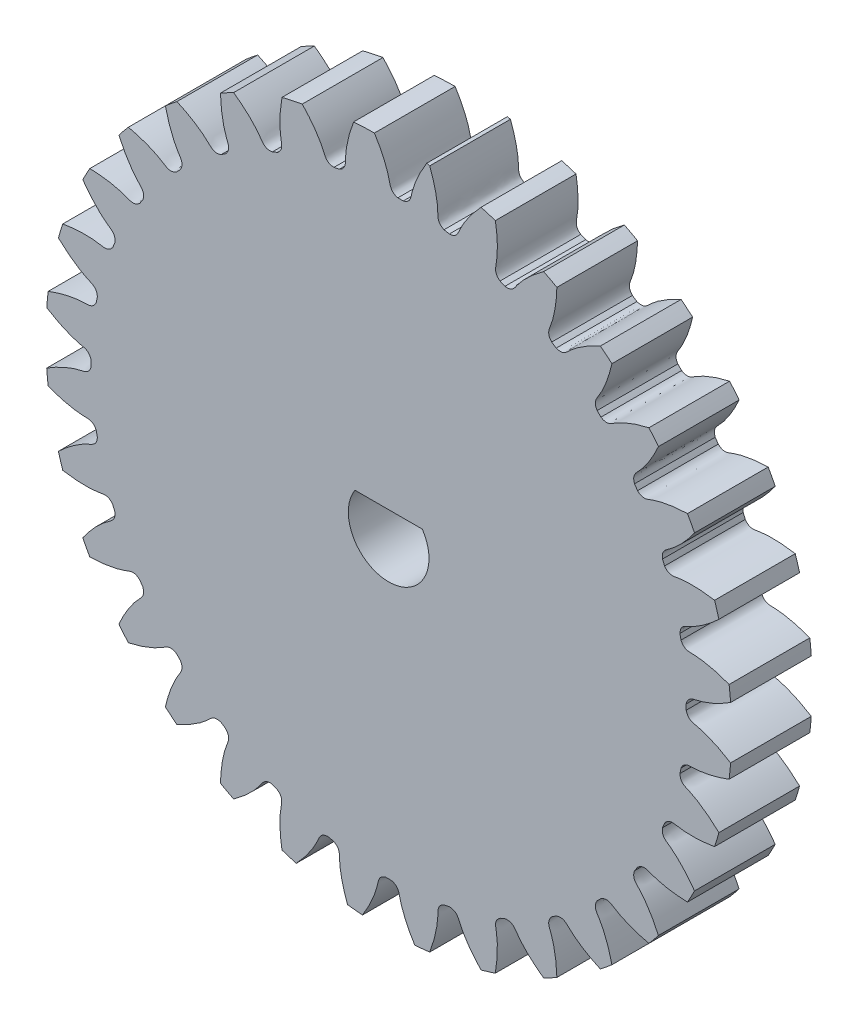
from build123d import *

# Parameters (mm, degrees)
EXTRUDE_1_DEPTH = 4


with BuildPart() as part:
    # 草图1 → 凸台-拉伸1 (new body)
    with BuildSketch(Plane.XY):
        with BuildLine():
            ThreePointArc((2.035278655, 16.877726174), (1.961192732, 16.897850599), (1.887016511, 16.917639603))
            add(Edge.make_bspline(
                [(1.887016511, 16.917639603), (1.838522747, 16.840615375), (1.742307559, 16.681804301), (1.610049844, 16.443752667), (1.492993766, 16.211703966), (1.395259616, 15.997067672), (1.315251975, 15.800982686), (1.251314979, 15.62448833), (1.208490215, 15.489735092), (1.180872939, 15.392512676), (1.163935477, 15.327913088), (1.098877666, 15.059564288), (1.079326327, 14.802321446), (0.724538936, 14.716542054)],
                knots=[0, 0, 0, 0, 0.048514786, 0.098957352, 0.145125777, 0.18702006, 0.224640202, 0.257986203, 0.287058062, 0.299991189, 0.31185578, 0.322651837, 0.447184516, 0.447184516, 0.447184516, 0.447184516], degree=3))
            ThreePointArc((0.724538936, 14.716542054), (0.590506823, 14.717151037), (0.45647471, 14.716542054))
            add(Edge.make_bspline(
                [(0.45647471, 14.716542054), (0.101687318, 14.802321446), (0.08213598, 15.059564288), (0.017078169, 15.327913088), (0.000140707, 15.392512676), (-0.027476569, 15.489735092), (-0.070301333, 15.62448833), (-0.134237826, 15.800982771), (-0.214245733, 15.997067661), (-0.311979866, 16.211703979), (-0.429036077, 16.44375267), (-0.561293368, 16.68180432), (-0.657509102, 16.840615375), (-0.706002865, 16.917639603)],
                knots=[0, 0, 0, 0, 0.124532679, 0.135328735, 0.147193327, 0.160126453, 0.189198313, 0.222544314, 0.260164456, 0.302058739, 0.348227164, 0.39866973, 0.447184516, 0.447184516, 0.447184516, 0.447184516], degree=3))
            ThreePointArc((-0.706002865, 16.917639603), (-1.22268931, 16.905533247), (-1.738768967, 16.877726174))
            add(Edge.make_bspline(
                [(-1.738768967, 16.877726174), (-1.771304255, 16.792721281), (-1.834688191, 16.618191065), (-1.917963042, 16.358911326), (-1.987499465, 16.108484868), (-2.041482217, 15.878905763), (-2.08169825, 15.670979779), (-2.109974374, 15.485403223), (-2.12568722, 15.344884534), (-2.133806685, 15.244142357), (-2.137815944, 15.177479697), (-2.149271434, 14.901594994), (-2.11826151, 14.645480724), (-2.449497032, 14.492133973)],
                knots=[0, 0, 0, 0, 0.048514786, 0.098957352, 0.145125777, 0.18702006, 0.224640202, 0.257986203, 0.287058062, 0.299991189, 0.31185578, 0.322651837, 0.447184516, 0.447184516, 0.447184516, 0.447184516], degree=3))
            ThreePointArc((-2.449497032, 14.492133973), (-2.581072562, 14.466582886), (-2.712410479, 14.439837237))
            add(Edge.make_bspline(
                [(-2.712410479, 14.439837237), (-3.077115459, 14.454752815), (-3.146476713, 14.703238531), (-3.26263671, 14.953738935), (-3.291851478, 15.013792925), (-3.337905248, 15.103759377), (-3.406196199, 15.227568671), (-3.503336528, 15.38819843), (-3.620061369, 15.564906836), (-3.757791037, 15.756351993), (-3.917868499, 15.9611054), (-4.094026077, 16.168780837), (-4.219375552, 16.305769624), (-4.281964203, 16.371853189)],
                knots=[0, 0, 0, 0, 0.124532679, 0.135328735, 0.147193327, 0.160126453, 0.189198313, 0.222544314, 0.260164456, 0.302058739, 0.348227164, 0.39866973, 0.447184516, 0.447184516, 0.447184516, 0.447184516], degree=3))
            ThreePointArc((-4.281964203, 16.371853189), (-4.787040201, 16.271732855), (-5.28885238, 16.15636223))
            add(Edge.make_bspline(
                [(-5.28885238, 16.15636223), (-5.30417888, 16.066643362), (-5.332295756, 15.883101103), (-5.363387535, 15.612557234), (-5.382732057, 15.353376767), (-5.390888884, 15.117677448), (-5.389767831, 14.905900944), (-5.381296447, 14.718373792), (-5.369293538, 14.577489706), (-5.357603167, 14.477099232), (-5.348530149, 14.410935309), (-5.305943089, 14.138116798), (-5.225563597, 13.892973428), (-5.520518054, 13.677952347)],
                knots=[0, 0, 0, 0, 0.048514786, 0.098957352, 0.145125777, 0.18702006, 0.224640202, 0.257986203, 0.287058062, 0.299991189, 0.31185578, 0.322651837, 0.447184516, 0.447184516, 0.447184516, 0.447184516], degree=3))
            ThreePointArc((-5.520518054, 13.677952347), (-5.644580627, 13.627223105), (-5.768177106, 13.575368609))
            add(Edge.make_bspline(
                [(-5.768177106, 13.575368609), (-6.128784267, 13.518847177), (-6.245289922, 13.7490266), (-6.408088142, 13.972052018), (-6.448457509, 14.025252569), (-6.511177953, 14.104505695), (-6.602310707, 14.212613125), (-6.728921823, 14.35120529), (-6.877877929, 14.501746407), (-7.050310258, 14.662643274), (-7.247257284, 14.832232838), (-7.460545511, 15.00155121), (-7.610211618, 15.111453327), (-7.684489909, 15.164056675)],
                knots=[0, 0, 0, 0, 0.124532679, 0.135328735, 0.147193327, 0.160126453, 0.189198313, 0.222544314, 0.260164456, 0.302058739, 0.348227164, 0.39866973, 0.447184516, 0.447184516, 0.447184516, 0.447184516], degree=3))
            ThreePointArc((-7.684489909, 15.164056675), (-8.013744526, 14.992661494), (-8.339178475, 14.814118346))
            add(Edge.make_bspline(
                [(-8.339178475, 14.814118346), (-8.336707198, 14.72313335), (-8.328476497, 14.537632473), (-8.306190366, 14.266221323), (-8.274599588, 14.008247007), (-8.236617027, 13.775485267), (-8.194201968, 13.567996695), (-8.149308627, 13.38572551), (-8.11005123, 13.249890124), (-8.079000275, 13.153709303), (-8.057193652, 13.090586759), (-7.962200639, 12.831318702), (-7.835540517, 12.606566955), (-8.082878975, 12.338134684)],
                knots=[0, 0, 0, 0, 0.048514786, 0.098957352, 0.145125777, 0.18702006, 0.224640202, 0.257986203, 0.287058062, 0.299991189, 0.31185578, 0.322651837, 0.447184516, 0.447184516, 0.447184516, 0.447184516], degree=3))
            ThreePointArc((-8.082878975, 12.338134684), (-8.194660937, 12.264176781), (-8.305766234, 12.189206179))
            add(Edge.make_bspline(
                [(-8.305766234, 12.189206179), (-8.648417645, 12.063419823), (-8.807590454, 12.266447287), (-9.010770653, 12.453426977), (-9.060743246, 12.497729622), (-9.137720052, 12.56322377), (-9.24819243, 12.651474828), (-9.399408738, 12.76270338), (-9.574871809, 12.881291996), (-9.775380321, 13.005457396), (-10.001628348, 13.133365886), (-10.243850678, 13.257820384), (-10.412081831, 13.336412354), (-10.49519529, 13.373513967)],
                knots=[0, 0, 0, 0, 0.124532679, 0.135328735, 0.147193327, 0.160126453, 0.189198313, 0.222544314, 0.260164456, 0.302058739, 0.348227164, 0.39866973, 0.447184516, 0.447184516, 0.447184516, 0.447184516], degree=3))
            ThreePointArc((-10.49519529, 13.373513967), (-10.784685831, 13.141177707), (-11.069034617, 12.902576202))
            add(Edge.make_bspline(
                [(-11.069034617, 12.902576202), (-11.048860533, 12.813821579), (-11.004598556, 12.633490779), (-10.929790959, 12.371642528), (-10.848478896, 12.124788171), (-10.765816597, 11.903908912), (-10.68373752, 11.708681943), (-10.604147447, 11.538671303), (-10.5391442, 11.413104694), (-10.489925934, 11.324829702), (-10.456223721, 11.267174301), (-10.312475284, 11.031420224), (-10.14440201, 10.835697183), (-10.334619391, 10.524169423)],
                knots=[0, 0, 0, 0, 0.048514786, 0.098957352, 0.145125777, 0.18702006, 0.224640202, 0.257986203, 0.287058062, 0.299991189, 0.31185578, 0.322651837, 0.447184516, 0.447184516, 0.447184516, 0.447184516], degree=3))
            ThreePointArc((-10.334619391, 10.524169423), (-10.429825023, 10.429825023), (-10.524169423, 10.334619391))
            add(Edge.make_bspline(
                [(-10.524169423, 10.334619391), (-10.835697183, 10.14440201), (-11.031420224, 10.312475284), (-11.267174301, 10.456223721), (-11.324829702, 10.489925934), (-11.413104694, 10.5391442), (-11.538671303, 10.604147447), (-11.708681647, 10.683737935), (-11.903908736, 10.765816758), (-12.124788, 10.848479085), (-12.371642444, 10.929791048), (-12.633490407, 11.004598956), (-12.813821579, 11.048860533), (-12.902576202, 11.069034617)],
                knots=[0, 0, 0, 0, 0.124532679, 0.135328735, 0.147193327, 0.160126453, 0.189198313, 0.222544314, 0.260164456, 0.302058739, 0.348227164, 0.39866973, 0.447184516, 0.447184516, 0.447184516, 0.447184516], degree=3))
            ThreePointArc((-12.902576202, 11.069034617), (-13.141177707, 10.784685831), (-13.373513967, 10.49519529))
            add(Edge.make_bspline(
                [(-13.373513967, 10.49519529), (-13.336412354, 10.412081831), (-13.257820065, 10.243851121), (-13.133365815, 10.001628448), (-13.005457245, 9.775380525), (-12.881291873, 9.574872013), (-12.762703029, 9.399409109), (-12.651474828, 9.24819243), (-12.56322377, 9.137720052), (-12.497729622, 9.060743246), (-12.453426977, 9.010770653), (-12.266447287, 8.807590454), (-12.063419823, 8.648417645), (-12.189206179, 8.305766234)],
                knots=[0, 0, 0, 0, 0.048514786, 0.098957352, 0.145125777, 0.18702006, 0.224640202, 0.257986203, 0.287058062, 0.299991189, 0.31185578, 0.322651837, 0.447184516, 0.447184516, 0.447184516, 0.447184516], degree=3))
            ThreePointArc((-12.189206179, 8.305766234), (-12.264176781, 8.194660937), (-12.338134684, 8.082878975))
            add(Edge.make_bspline(
                [(-12.338134684, 8.082878975), (-12.606566955, 7.835540517), (-12.831318702, 7.962200639), (-13.090586759, 8.057193652), (-13.153709303, 8.079000275), (-13.249890124, 8.11005123), (-13.38572551, 8.149308627), (-13.567996487, 8.194202434), (-13.775485126, 8.236617219), (-14.008246877, 8.274599806), (-14.266221258, 8.306190469), (-14.537632185, 8.328476961), (-14.72313335, 8.336707198), (-14.814118346, 8.339178475)],
                knots=[0, 0, 0, 0, 0.124532679, 0.135328735, 0.147193327, 0.160126453, 0.189198313, 0.222544314, 0.260164456, 0.302058739, 0.348227164, 0.39866973, 0.447184516, 0.447184516, 0.447184516, 0.447184516], degree=3))
            ThreePointArc((-14.814118346, 8.339178475), (-14.992661494, 8.013744526), (-15.164056675, 7.684489909))
            add(Edge.make_bspline(
                [(-15.164056675, 7.684489909), (-15.111453327, 7.610211618), (-15.001550984, 7.460546008), (-14.832232788, 7.247257396), (-14.662643165, 7.050310487), (-14.501746326, 6.877878153), (-14.351205019, 6.728922255), (-14.212613125, 6.602310707), (-14.104505695, 6.511177953), (-14.025252569, 6.448457509), (-13.972052018, 6.408088142), (-13.7490266, 6.245289922), (-13.518847177, 6.128784267), (-13.575368609, 5.768177106)],
                knots=[0, 0, 0, 0, 0.048514786, 0.098957352, 0.145125777, 0.18702006, 0.224640202, 0.257986203, 0.287058062, 0.299991189, 0.31185578, 0.322651837, 0.447184516, 0.447184516, 0.447184516, 0.447184516], degree=3))
            ThreePointArc((-13.575368609, 5.768177106), (-13.627223105, 5.644580627), (-13.677952347, 5.520518054))
            add(Edge.make_bspline(
                [(-13.677952347, 5.520518054), (-13.892973428, 5.225563597), (-14.138116798, 5.305943089), (-14.410935309, 5.348530149), (-14.477099232, 5.357603167), (-14.577489706, 5.369293538), (-14.718373792, 5.381296447), (-14.90590083, 5.389768328), (-15.117677347, 5.3908891), (-15.353376682, 5.382732297), (-15.612557191, 5.363387649), (-15.883100912, 5.332296267), (-16.066643362, 5.30417888), (-16.15636223, 5.28885238)],
                knots=[0, 0, 0, 0, 0.124532679, 0.135328735, 0.147193327, 0.160126453, 0.189198313, 0.222544314, 0.260164456, 0.302058739, 0.348227164, 0.39866973, 0.447184516, 0.447184516, 0.447184516, 0.447184516], degree=3))
            ThreePointArc((-16.15636223, 5.28885238), (-16.267985707, 4.934839513), (-16.371853189, 4.57847389))
            add(Edge.make_bspline(
                [(-16.371853189, 4.57847389), (-16.305769624, 4.51588524), (-16.168780712, 4.390536296), (-15.961105373, 4.214378306), (-15.756351931, 4.054300971), (-15.5649068, 3.916571292), (-15.388198249, 3.799846692), (-15.227568671, 3.702705887), (-15.103759377, 3.634414936), (-15.013792925, 3.588361166), (-14.953738935, 3.559146398), (-14.703238531, 3.442986401), (-14.454752815, 3.373625147), (-14.439837237, 3.008920167)],
                knots=[0, 0, 0, 0, 0.048514786, 0.098957352, 0.145125777, 0.18702006, 0.224640202, 0.257986203, 0.287058062, 0.299991189, 0.31185578, 0.322651837, 0.447184516, 0.447184516, 0.447184516, 0.447184516], degree=3))
            ThreePointArc((-14.439837237, 3.008920167), (-14.466582886, 2.87758225), (-14.492133973, 2.746006719))
            add(Edge.make_bspline(
                [(-14.492133973, 2.746006719), (-14.645480724, 2.414771197), (-14.901594994, 2.445781121), (-15.177479697, 2.434325632), (-15.244142357, 2.430316373), (-15.344884534, 2.422196908), (-15.485403223, 2.406484062), (-15.670979764, 2.378208448), (-15.878905706, 2.337992135), (-16.108484831, 2.284009404), (-16.358911305, 2.21447285), (-16.618190977, 2.131198418), (-16.792721281, 2.067813943), (-16.877726174, 2.035278655)],
                knots=[0, 0, 0, 0, 0.124532679, 0.135328735, 0.147193327, 0.160126453, 0.189198313, 0.222544314, 0.260164456, 0.302058739, 0.348227164, 0.39866973, 0.447184516, 0.447184516, 0.447184516, 0.447184516], degree=3))
            ThreePointArc((-16.877726174, 2.035278655), (-16.918140353, 1.666291386), (-16.950488566, 1.296509688))
            add(Edge.make_bspline(
                [(-16.950488566, 1.296509688), (-16.873464339, 1.248015924), (-16.714653264, 1.151800737), (-16.47660163, 1.019543022), (-16.244552929, 0.902486943), (-16.029916635, 0.804752793), (-15.833831649, 0.724745152), (-15.657337293, 0.660808156), (-15.522584055, 0.617983392), (-15.42536164, 0.590366116), (-15.360762052, 0.573428654), (-15.092413251, 0.508370843), (-14.835170409, 0.488819505), (-14.749391018, 0.134032113)],
                knots=[0, 0, 0, 0, 0.048514786, 0.098957352, 0.145125777, 0.18702006, 0.224640202, 0.257986203, 0.287058062, 0.299991189, 0.31185578, 0.322651837, 0.447184516, 0.447184516, 0.447184516, 0.447184516], degree=3))
            ThreePointArc((-14.749391018, 0.134032113), (-14.75, 0), (-14.749391018, -0.134032113))
            add(Edge.make_bspline(
                [(-14.749391018, -0.134032113), (-14.835170409, -0.488819505), (-15.092413251, -0.508370843), (-15.360762052, -0.573428654), (-15.42536164, -0.590366116), (-15.522584055, -0.617983392), (-15.657337293, -0.660808156), (-15.833831734, -0.724744649), (-16.029916624, -0.804752555), (-16.244552942, -0.902486689), (-16.476601633, -1.0195429), (-16.714653283, -1.151800191), (-16.873464339, -1.248015924), (-16.950488566, -1.296509688)],
                knots=[0, 0, 0, 0, 0.124532679, 0.135328735, 0.147193327, 0.160126453, 0.189198313, 0.222544314, 0.260164456, 0.302058739, 0.348227164, 0.39866973, 0.447184516, 0.447184516, 0.447184516, 0.447184516], degree=3))
            ThreePointArc((-16.950488566, -1.296509688), (-16.918140353, -1.666291386), (-16.877726174, -2.035278655))
            add(Edge.make_bspline(
                [(-16.877726174, -2.035278655), (-16.792721281, -2.067813943), (-16.618191065, -2.131197879), (-16.358911326, -2.214472729), (-16.108484868, -2.284009152), (-15.878905763, -2.337991904), (-15.670979779, -2.378207938), (-15.485403223, -2.406484062), (-15.344884534, -2.422196908), (-15.244142357, -2.430316373), (-15.177479697, -2.434325632), (-14.901594994, -2.445781121), (-14.645480724, -2.414771197), (-14.492133973, -2.746006719)],
                knots=[0, 0, 0, 0, 0.048514786, 0.098957352, 0.145125777, 0.18702006, 0.224640202, 0.257986203, 0.287058062, 0.299991189, 0.31185578, 0.322651837, 0.447184516, 0.447184516, 0.447184516, 0.447184516], degree=3))
            ThreePointArc((-14.492133973, -2.746006719), (-14.466582886, -2.87758225), (-14.439837237, -3.008920167))
            add(Edge.make_bspline(
                [(-14.439837237, -3.008920167), (-14.454752815, -3.373625147), (-14.703238531, -3.442986401), (-14.953738935, -3.559146398), (-15.013792925, -3.588361166), (-15.103759377, -3.634414936), (-15.227568671, -3.702705887), (-15.38819843, -3.799846215), (-15.564906836, -3.916571057), (-15.756351993, -4.054300725), (-15.9611054, -4.214378187), (-16.168780837, -4.390535765), (-16.305769624, -4.51588524), (-16.371853189, -4.57847389)],
                knots=[0, 0, 0, 0, 0.124532679, 0.135328735, 0.147193327, 0.160126453, 0.189198313, 0.222544314, 0.260164456, 0.302058739, 0.348227164, 0.39866973, 0.447184516, 0.447184516, 0.447184516, 0.447184516], degree=3))
            ThreePointArc((-16.371853189, -4.57847389), (-16.267985707, -4.934839513), (-16.15636223, -5.28885238))
            add(Edge.make_bspline(
                [(-16.15636223, -5.28885238), (-16.066643362, -5.30417888), (-15.883101103, -5.332295756), (-15.612557234, -5.363387535), (-15.353376767, -5.382732057), (-15.117677448, -5.390888884), (-14.905900944, -5.389767831), (-14.718373792, -5.381296447), (-14.577489706, -5.369293538), (-14.477099232, -5.357603167), (-14.410935309, -5.348530149), (-14.138116798, -5.305943089), (-13.892973428, -5.225563597), (-13.677952347, -5.520518054)],
                knots=[0, 0, 0, 0, 0.048514786, 0.098957352, 0.145125777, 0.18702006, 0.224640202, 0.257986203, 0.287058062, 0.299991189, 0.31185578, 0.322651837, 0.447184516, 0.447184516, 0.447184516, 0.447184516], degree=3))
            ThreePointArc((-13.677952347, -5.520518054), (-13.627223105, -5.644580627), (-13.575368609, -5.768177106))
            add(Edge.make_bspline(
                [(-13.575368609, -5.768177106), (-13.518847177, -6.128784267), (-13.7490266, -6.245289922), (-13.972052018, -6.408088142), (-14.025252569, -6.448457509), (-14.104505695, -6.511177953), (-14.212613125, -6.602310707), (-14.35120529, -6.728921823), (-14.501746407, -6.877877929), (-14.662643274, -7.050310258), (-14.832232838, -7.247257284), (-15.00155121, -7.460545511), (-15.111453327, -7.610211618), (-15.164056675, -7.684489909)],
                knots=[0, 0, 0, 0, 0.124532679, 0.135328735, 0.147193327, 0.160126453, 0.189198313, 0.222544314, 0.260164456, 0.302058739, 0.348227164, 0.39866973, 0.447184516, 0.447184516, 0.447184516, 0.447184516], degree=3))
            ThreePointArc((-15.164056675, -7.684489909), (-14.992661494, -8.013744526), (-14.814118346, -8.339178475))
            add(Edge.make_bspline(
                [(-14.814118346, -8.339178475), (-14.72313335, -8.336707198), (-14.537632473, -8.328476497), (-14.266221323, -8.306190366), (-14.008247007, -8.274599588), (-13.775485267, -8.236617027), (-13.567996695, -8.194201968), (-13.38572551, -8.149308627), (-13.249890124, -8.11005123), (-13.153709303, -8.079000275), (-13.090586759, -8.057193652), (-12.831318702, -7.962200639), (-12.606566955, -7.835540517), (-12.338134684, -8.082878975)],
                knots=[0, 0, 0, 0, 0.048514786, 0.098957352, 0.145125777, 0.18702006, 0.224640202, 0.257986203, 0.287058062, 0.299991189, 0.31185578, 0.322651837, 0.447184516, 0.447184516, 0.447184516, 0.447184516], degree=3))
            ThreePointArc((-12.338134684, -8.082878975), (-12.264176781, -8.194660937), (-12.189206179, -8.305766234))
            add(Edge.make_bspline(
                [(-12.189206179, -8.305766234), (-12.063419823, -8.648417645), (-12.266447287, -8.807590454), (-12.453426977, -9.010770653), (-12.497729622, -9.060743246), (-12.56322377, -9.137720052), (-12.651474828, -9.24819243), (-12.76270338, -9.399408738), (-12.881291996, -9.574871809), (-13.005457396, -9.775380321), (-13.133365886, -10.001628348), (-13.257820384, -10.243850678), (-13.336412354, -10.412081831), (-13.373513967, -10.49519529)],
                knots=[0, 0, 0, 0, 0.124532679, 0.135328735, 0.147193327, 0.160126453, 0.189198313, 0.222544314, 0.260164456, 0.302058739, 0.348227164, 0.39866973, 0.447184516, 0.447184516, 0.447184516, 0.447184516], degree=3))
            ThreePointArc((-13.373513967, -10.49519529), (-13.141177707, -10.784685831), (-12.902576202, -11.069034617))
            add(Edge.make_bspline(
                [(-12.902576202, -11.069034617), (-12.813821579, -11.048860533), (-12.633490779, -11.004598556), (-12.371642528, -10.929790959), (-12.124788171, -10.848478896), (-11.903908912, -10.765816597), (-11.708681943, -10.68373752), (-11.538671303, -10.604147447), (-11.413104694, -10.5391442), (-11.324829702, -10.489925934), (-11.267174301, -10.456223721), (-11.031420224, -10.312475284), (-10.835697183, -10.14440201), (-10.524169423, -10.334619391)],
                knots=[0, 0, 0, 0, 0.048514786, 0.098957352, 0.145125777, 0.18702006, 0.224640202, 0.257986203, 0.287058062, 0.299991189, 0.31185578, 0.322651837, 0.447184516, 0.447184516, 0.447184516, 0.447184516], degree=3))
            ThreePointArc((-10.524169423, -10.334619391), (-10.429825023, -10.429825023), (-10.334619391, -10.524169423))
            add(Edge.make_bspline(
                [(-10.334619391, -10.524169423), (-10.14440201, -10.835697183), (-10.312475284, -11.031420224), (-10.456223721, -11.267174301), (-10.489925934, -11.324829702), (-10.5391442, -11.413104694), (-10.604147447, -11.538671303), (-10.683737935, -11.708681647), (-10.765816758, -11.903908736), (-10.848479085, -12.124788), (-10.929791048, -12.371642444), (-11.004598956, -12.633490407), (-11.048860533, -12.813821579), (-11.069034617, -12.902576202)],
                knots=[0, 0, 0, 0, 0.124532679, 0.135328735, 0.147193327, 0.160126453, 0.189198313, 0.222544314, 0.260164456, 0.302058739, 0.348227164, 0.39866973, 0.447184516, 0.447184516, 0.447184516, 0.447184516], degree=3))
            ThreePointArc((-11.069034617, -12.902576202), (-10.784685831, -13.141177707), (-10.49519529, -13.373513967))
            add(Edge.make_bspline(
                [(-10.49519529, -13.373513967), (-10.412081831, -13.336412354), (-10.243851121, -13.257820065), (-10.001628448, -13.133365815), (-9.775380525, -13.005457245), (-9.574872013, -12.881291873), (-9.399409109, -12.762703029), (-9.24819243, -12.651474828), (-9.137720052, -12.56322377), (-9.060743246, -12.497729622), (-9.010770653, -12.453426977), (-8.807590454, -12.266447287), (-8.648417645, -12.063419823), (-8.305766234, -12.189206179)],
                knots=[0, 0, 0, 0, 0.048514786, 0.098957352, 0.145125777, 0.18702006, 0.224640202, 0.257986203, 0.287058062, 0.299991189, 0.31185578, 0.322651837, 0.447184516, 0.447184516, 0.447184516, 0.447184516], degree=3))
            ThreePointArc((-8.305766234, -12.189206179), (-8.194660937, -12.264176781), (-8.082878975, -12.338134684))
            add(Edge.make_bspline(
                [(-8.082878975, -12.338134684), (-7.835540517, -12.606566955), (-7.962200639, -12.831318702), (-8.057193652, -13.090586759), (-8.079000275, -13.153709303), (-8.11005123, -13.249890124), (-8.149308627, -13.38572551), (-8.194202434, -13.567996487), (-8.236617219, -13.775485126), (-8.274599806, -14.008246877), (-8.306190469, -14.266221258), (-8.328476961, -14.537632185), (-8.336707198, -14.72313335), (-8.339178475, -14.814118346)],
                knots=[0, 0, 0, 0, 0.124532679, 0.135328735, 0.147193327, 0.160126453, 0.189198313, 0.222544314, 0.260164456, 0.302058739, 0.348227164, 0.39866973, 0.447184516, 0.447184516, 0.447184516, 0.447184516], degree=3))
            ThreePointArc((-8.339178475, -14.814118346), (-8.013744526, -14.992661494), (-7.684489909, -15.164056675))
            add(Edge.make_bspline(
                [(-7.684489909, -15.164056675), (-7.610211618, -15.111453327), (-7.460546008, -15.001550984), (-7.247257396, -14.832232788), (-7.050310487, -14.662643165), (-6.877878153, -14.501746326), (-6.728922255, -14.351205019), (-6.602310707, -14.212613125), (-6.511177953, -14.104505695), (-6.448457509, -14.025252569), (-6.408088142, -13.972052018), (-6.245289922, -13.7490266), (-6.128784267, -13.518847177), (-5.768177106, -13.575368609)],
                knots=[0, 0, 0, 0, 0.048514786, 0.098957352, 0.145125777, 0.18702006, 0.224640202, 0.257986203, 0.287058062, 0.299991189, 0.31185578, 0.322651837, 0.447184516, 0.447184516, 0.447184516, 0.447184516], degree=3))
            ThreePointArc((-5.768177106, -13.575368609), (-5.644580627, -13.627223105), (-5.520518054, -13.677952347))
            add(Edge.make_bspline(
                [(-5.520518054, -13.677952347), (-5.225563597, -13.892973428), (-5.305943089, -14.138116798), (-5.348530149, -14.410935309), (-5.357603167, -14.477099232), (-5.369293538, -14.577489706), (-5.381296447, -14.718373792), (-5.389768328, -14.90590083), (-5.3908891, -15.117677347), (-5.382732297, -15.353376682), (-5.363387649, -15.612557191), (-5.332296267, -15.883100912), (-5.30417888, -16.066643362), (-5.28885238, -16.15636223)],
                knots=[0, 0, 0, 0, 0.124532679, 0.135328735, 0.147193327, 0.160126453, 0.189198313, 0.222544314, 0.260164456, 0.302058739, 0.348227164, 0.39866973, 0.447184516, 0.447184516, 0.447184516, 0.447184516], degree=3))
            ThreePointArc((-5.28885238, -16.15636223), (-4.934839513, -16.267985707), (-4.57847389, -16.371853189))
            add(Edge.make_bspline(
                [(-4.57847389, -16.371853189), (-4.51588524, -16.305769624), (-4.390536296, -16.168780712), (-4.214378306, -15.961105373), (-4.054300971, -15.756351931), (-3.916571292, -15.5649068), (-3.799846692, -15.388198249), (-3.702705887, -15.227568671), (-3.634414936, -15.103759377), (-3.588361166, -15.013792925), (-3.559146398, -14.953738935), (-3.442986401, -14.703238531), (-3.373625147, -14.454752815), (-3.008920167, -14.439837237)],
                knots=[0, 0, 0, 0, 0.048514786, 0.098957352, 0.145125777, 0.18702006, 0.224640202, 0.257986203, 0.287058062, 0.299991189, 0.31185578, 0.322651837, 0.447184516, 0.447184516, 0.447184516, 0.447184516], degree=3))
            ThreePointArc((-3.008920167, -14.439837237), (-2.87758225, -14.466582886), (-2.746006719, -14.492133973))
            add(Edge.make_bspline(
                [(-2.746006719, -14.492133973), (-2.414771197, -14.645480724), (-2.445781121, -14.901594994), (-2.434325632, -15.177479697), (-2.430316373, -15.244142357), (-2.422196908, -15.344884534), (-2.406484062, -15.485403223), (-2.378208448, -15.670979764), (-2.337992135, -15.878905706), (-2.284009404, -16.108484831), (-2.21447285, -16.358911305), (-2.131198418, -16.618190977), (-2.067813943, -16.792721281), (-2.035278655, -16.877726174)],
                knots=[0, 0, 0, 0, 0.124532679, 0.135328735, 0.147193327, 0.160126453, 0.189198313, 0.222544314, 0.260164456, 0.302058739, 0.348227164, 0.39866973, 0.447184516, 0.447184516, 0.447184516, 0.447184516], degree=3))
            ThreePointArc((-2.035278655, -16.877726174), (-1.666291386, -16.918140353), (-1.296509688, -16.950488566))
            add(Edge.make_bspline(
                [(-1.296509688, -16.950488566), (-1.248015924, -16.873464339), (-1.151800737, -16.714653264), (-1.019543022, -16.47660163), (-0.902486943, -16.244552929), (-0.804752793, -16.029916635), (-0.724745152, -15.833831649), (-0.660808156, -15.657337293), (-0.617983392, -15.522584055), (-0.590366116, -15.42536164), (-0.573428654, -15.360762052), (-0.508370843, -15.092413251), (-0.488819505, -14.835170409), (-0.134032113, -14.749391018)],
                knots=[0, 0, 0, 0, 0.048514786, 0.098957352, 0.145125777, 0.18702006, 0.224640202, 0.257986203, 0.287058062, 0.299991189, 0.31185578, 0.322651837, 0.447184516, 0.447184516, 0.447184516, 0.447184516], degree=3))
            ThreePointArc((-0.134032113, -14.749391018), (0, -14.75), (0.134032113, -14.749391018))
            add(Edge.make_bspline(
                [(0.134032113, -14.749391018), (0.488819505, -14.835170409), (0.508370843, -15.092413251), (0.573428654, -15.360762052), (0.590366116, -15.42536164), (0.617983392, -15.522584055), (0.660808156, -15.657337293), (0.724744649, -15.833831734), (0.804752555, -16.029916624), (0.902486689, -16.244552942), (1.0195429, -16.476601633), (1.151800191, -16.714653283), (1.248015924, -16.873464339), (1.296509688, -16.950488566)],
                knots=[0, 0, 0, 0, 0.124532679, 0.135328735, 0.147193327, 0.160126453, 0.189198313, 0.222544314, 0.260164456, 0.302058739, 0.348227164, 0.39866973, 0.447184516, 0.447184516, 0.447184516, 0.447184516], degree=3))
            ThreePointArc((1.296509688, -16.950488566), (1.666291386, -16.918140353), (2.035278655, -16.877726174))
            add(Edge.make_bspline(
                [(2.035278655, -16.877726174), (2.067813943, -16.792721281), (2.131197879, -16.618191065), (2.214472729, -16.358911326), (2.284009152, -16.108484868), (2.337991904, -15.878905763), (2.378207938, -15.670979779), (2.406484062, -15.485403223), (2.422196908, -15.344884534), (2.430316373, -15.244142357), (2.434325632, -15.177479697), (2.445781121, -14.901594994), (2.414771197, -14.645480724), (2.746006719, -14.492133973)],
                knots=[0, 0, 0, 0, 0.048514786, 0.098957352, 0.145125777, 0.18702006, 0.224640202, 0.257986203, 0.287058062, 0.299991189, 0.31185578, 0.322651837, 0.447184516, 0.447184516, 0.447184516, 0.447184516], degree=3))
            ThreePointArc((2.746006719, -14.492133973), (2.87758225, -14.466582886), (3.008920167, -14.439837237))
            add(Edge.make_bspline(
                [(3.008920167, -14.439837237), (3.373625147, -14.454752815), (3.442986401, -14.703238531), (3.559146398, -14.953738935), (3.588361166, -15.013792925), (3.634414936, -15.103759377), (3.702705887, -15.227568671), (3.799846215, -15.38819843), (3.916571057, -15.564906836), (4.054300725, -15.756351993), (4.214378187, -15.9611054), (4.390535765, -16.168780837), (4.51588524, -16.305769624), (4.57847389, -16.371853189)],
                knots=[0, 0, 0, 0, 0.124532679, 0.135328735, 0.147193327, 0.160126453, 0.189198313, 0.222544314, 0.260164456, 0.302058739, 0.348227164, 0.39866973, 0.447184516, 0.447184516, 0.447184516, 0.447184516], degree=3))
            ThreePointArc((4.57847389, -16.371853189), (4.934839513, -16.267985707), (5.28885238, -16.15636223))
            add(Edge.make_bspline(
                [(5.28885238, -16.15636223), (5.30417888, -16.066643362), (5.332295756, -15.883101103), (5.363387535, -15.612557234), (5.382732057, -15.353376767), (5.390888884, -15.117677448), (5.389767831, -14.905900944), (5.381296447, -14.718373792), (5.369293538, -14.577489706), (5.357603167, -14.477099232), (5.348530149, -14.410935309), (5.305943089, -14.138116798), (5.225563597, -13.892973428), (5.520518054, -13.677952347)],
                knots=[0, 0, 0, 0, 0.048514786, 0.098957352, 0.145125777, 0.18702006, 0.224640202, 0.257986203, 0.287058062, 0.299991189, 0.31185578, 0.322651837, 0.447184516, 0.447184516, 0.447184516, 0.447184516], degree=3))
            ThreePointArc((5.520518054, -13.677952347), (5.644580627, -13.627223105), (5.768177106, -13.575368609))
            add(Edge.make_bspline(
                [(5.768177106, -13.575368609), (6.128784267, -13.518847177), (6.245289922, -13.7490266), (6.408088142, -13.972052018), (6.448457509, -14.025252569), (6.511177953, -14.104505695), (6.602310707, -14.212613125), (6.728921823, -14.35120529), (6.877877929, -14.501746407), (7.050310258, -14.662643274), (7.247257284, -14.832232838), (7.460545511, -15.00155121), (7.610211618, -15.111453327), (7.684489909, -15.164056675)],
                knots=[0, 0, 0, 0, 0.124532679, 0.135328735, 0.147193327, 0.160126453, 0.189198313, 0.222544314, 0.260164456, 0.302058739, 0.348227164, 0.39866973, 0.447184516, 0.447184516, 0.447184516, 0.447184516], degree=3))
            ThreePointArc((7.684489909, -15.164056675), (8.013744526, -14.992661494), (8.339178475, -14.814118346))
            add(Edge.make_bspline(
                [(8.339178475, -14.814118346), (8.336707198, -14.72313335), (8.328476497, -14.537632473), (8.306190366, -14.266221323), (8.274599588, -14.008247007), (8.236617027, -13.775485267), (8.194201968, -13.567996695), (8.149308627, -13.38572551), (8.11005123, -13.249890124), (8.079000275, -13.153709303), (8.057193652, -13.090586759), (7.962200639, -12.831318702), (7.835540517, -12.606566955), (8.082878975, -12.338134684)],
                knots=[0, 0, 0, 0, 0.048514786, 0.098957352, 0.145125777, 0.18702006, 0.224640202, 0.257986203, 0.287058062, 0.299991189, 0.31185578, 0.322651837, 0.447184516, 0.447184516, 0.447184516, 0.447184516], degree=3))
            ThreePointArc((8.082878975, -12.338134684), (8.194660937, -12.264176781), (8.305766234, -12.189206179))
            add(Edge.make_bspline(
                [(8.305766234, -12.189206179), (8.648417645, -12.063419823), (8.807590454, -12.266447287), (9.010770653, -12.453426977), (9.060743246, -12.497729622), (9.137720052, -12.56322377), (9.24819243, -12.651474828), (9.399408738, -12.76270338), (9.574871809, -12.881291996), (9.775380321, -13.005457396), (10.001628348, -13.133365886), (10.243850678, -13.257820384), (10.412081831, -13.336412354), (10.49519529, -13.373513967)],
                knots=[0, 0, 0, 0, 0.124532679, 0.135328735, 0.147193327, 0.160126453, 0.189198313, 0.222544314, 0.260164456, 0.302058739, 0.348227164, 0.39866973, 0.447184516, 0.447184516, 0.447184516, 0.447184516], degree=3))
            ThreePointArc((10.49519529, -13.373513967), (10.784685831, -13.141177707), (11.069034617, -12.902576202))
            add(Edge.make_bspline(
                [(11.069034617, -12.902576202), (11.048860533, -12.813821579), (11.004598556, -12.633490779), (10.929790959, -12.371642528), (10.848478896, -12.124788171), (10.765816597, -11.903908912), (10.68373752, -11.708681943), (10.604147447, -11.538671303), (10.5391442, -11.413104694), (10.489925934, -11.324829702), (10.456223721, -11.267174301), (10.312475284, -11.031420224), (10.14440201, -10.835697183), (10.334619391, -10.524169423)],
                knots=[0, 0, 0, 0, 0.048514786, 0.098957352, 0.145125777, 0.18702006, 0.224640202, 0.257986203, 0.287058062, 0.299991189, 0.31185578, 0.322651837, 0.447184516, 0.447184516, 0.447184516, 0.447184516], degree=3))
            ThreePointArc((10.334619391, -10.524169423), (10.429825023, -10.429825023), (10.524169423, -10.334619391))
            add(Edge.make_bspline(
                [(10.524169423, -10.334619391), (10.835697183, -10.14440201), (11.031420224, -10.312475284), (11.267174301, -10.456223721), (11.324829702, -10.489925934), (11.413104694, -10.5391442), (11.538671303, -10.604147447), (11.708681647, -10.683737935), (11.903908736, -10.765816758), (12.124788, -10.848479085), (12.371642444, -10.929791048), (12.633490407, -11.004598956), (12.813821579, -11.048860533), (12.902576202, -11.069034617)],
                knots=[0, 0, 0, 0, 0.124532679, 0.135328735, 0.147193327, 0.160126453, 0.189198313, 0.222544314, 0.260164456, 0.302058739, 0.348227164, 0.39866973, 0.447184516, 0.447184516, 0.447184516, 0.447184516], degree=3))
            ThreePointArc((12.902576202, -11.069034617), (13.141177707, -10.784685831), (13.373513967, -10.49519529))
            add(Edge.make_bspline(
                [(13.373513967, -10.49519529), (13.336412354, -10.412081831), (13.257820065, -10.243851121), (13.133365815, -10.001628448), (13.005457245, -9.775380525), (12.881291873, -9.574872013), (12.762703029, -9.399409109), (12.651474828, -9.24819243), (12.56322377, -9.137720052), (12.497729622, -9.060743246), (12.453426977, -9.010770653), (12.266447287, -8.807590454), (12.063419823, -8.648417645), (12.189206179, -8.305766234)],
                knots=[0, 0, 0, 0, 0.048514786, 0.098957352, 0.145125777, 0.18702006, 0.224640202, 0.257986203, 0.287058062, 0.299991189, 0.31185578, 0.322651837, 0.447184516, 0.447184516, 0.447184516, 0.447184516], degree=3))
            ThreePointArc((12.189206179, -8.305766234), (12.264176781, -8.194660937), (12.338134684, -8.082878975))
            add(Edge.make_bspline(
                [(12.338134684, -8.082878975), (12.606566955, -7.835540517), (12.831318702, -7.962200639), (13.090586759, -8.057193652), (13.153709303, -8.079000275), (13.249890124, -8.11005123), (13.38572551, -8.149308627), (13.567996487, -8.194202434), (13.775485126, -8.236617219), (14.008246877, -8.274599806), (14.266221258, -8.306190469), (14.537632185, -8.328476961), (14.72313335, -8.336707198), (14.814118346, -8.339178475)],
                knots=[0, 0, 0, 0, 0.124532679, 0.135328735, 0.147193327, 0.160126453, 0.189198313, 0.222544314, 0.260164456, 0.302058739, 0.348227164, 0.39866973, 0.447184516, 0.447184516, 0.447184516, 0.447184516], degree=3))
            ThreePointArc((14.814118346, -8.339178475), (14.992661494, -8.013744526), (15.164056675, -7.684489909))
            add(Edge.make_bspline(
                [(15.164056675, -7.684489909), (15.111453327, -7.610211618), (15.001550984, -7.460546008), (14.832232788, -7.247257396), (14.662643165, -7.050310487), (14.501746326, -6.877878153), (14.351205019, -6.728922255), (14.212613125, -6.602310707), (14.104505695, -6.511177953), (14.025252569, -6.448457509), (13.972052018, -6.408088142), (13.7490266, -6.245289922), (13.518847177, -6.128784267), (13.575368609, -5.768177106)],
                knots=[0, 0, 0, 0, 0.048514786, 0.098957352, 0.145125777, 0.18702006, 0.224640202, 0.257986203, 0.287058062, 0.299991189, 0.31185578, 0.322651837, 0.447184516, 0.447184516, 0.447184516, 0.447184516], degree=3))
            ThreePointArc((13.575368609, -5.768177106), (13.627223105, -5.644580627), (13.677952347, -5.520518054))
            add(Edge.make_bspline(
                [(13.677952347, -5.520518054), (13.892973428, -5.225563597), (14.138116798, -5.305943089), (14.410935309, -5.348530149), (14.477099232, -5.357603167), (14.577489706, -5.369293538), (14.718373792, -5.381296447), (14.90590083, -5.389768328), (15.117677347, -5.3908891), (15.353376682, -5.382732297), (15.612557191, -5.363387649), (15.883100912, -5.332296267), (16.066643362, -5.30417888), (16.15636223, -5.28885238)],
                knots=[0, 0, 0, 0, 0.124532679, 0.135328735, 0.147193327, 0.160126453, 0.189198313, 0.222544314, 0.260164456, 0.302058739, 0.348227164, 0.39866973, 0.447184516, 0.447184516, 0.447184516, 0.447184516], degree=3))
            ThreePointArc((16.15636223, -5.28885238), (16.267985707, -4.934839513), (16.371853189, -4.57847389))
            add(Edge.make_bspline(
                [(16.371853189, -4.57847389), (16.305769624, -4.51588524), (16.168780712, -4.390536296), (15.961105373, -4.214378306), (15.756351931, -4.054300971), (15.5649068, -3.916571292), (15.388198249, -3.799846692), (15.227568671, -3.702705887), (15.103759377, -3.634414936), (15.013792925, -3.588361166), (14.953738935, -3.559146398), (14.703238531, -3.442986401), (14.454752815, -3.373625147), (14.439837237, -3.008920167)],
                knots=[0, 0, 0, 0, 0.048514786, 0.098957352, 0.145125777, 0.18702006, 0.224640202, 0.257986203, 0.287058062, 0.299991189, 0.31185578, 0.322651837, 0.447184516, 0.447184516, 0.447184516, 0.447184516], degree=3))
            ThreePointArc((14.439837237, -3.008920167), (14.466582886, -2.87758225), (14.492133973, -2.746006719))
            add(Edge.make_bspline(
                [(14.492133973, -2.746006719), (14.645480724, -2.414771197), (14.901594994, -2.445781121), (15.177479697, -2.434325632), (15.244142357, -2.430316373), (15.344884534, -2.422196908), (15.485403223, -2.406484062), (15.670979764, -2.378208448), (15.878905706, -2.337992135), (16.108484831, -2.284009404), (16.358911305, -2.21447285), (16.618190977, -2.131198418), (16.792721281, -2.067813943), (16.877726174, -2.035278655)],
                knots=[0, 0, 0, 0, 0.124532679, 0.135328735, 0.147193327, 0.160126453, 0.189198313, 0.222544314, 0.260164456, 0.302058739, 0.348227164, 0.39866973, 0.447184516, 0.447184516, 0.447184516, 0.447184516], degree=3))
            ThreePointArc((16.877726174, -2.035278655), (16.918140353, -1.666291386), (16.950488566, -1.296509688))
            add(Edge.make_bspline(
                [(16.950488566, -1.296509688), (16.873464339, -1.248015924), (16.714653264, -1.151800737), (16.47660163, -1.019543022), (16.244552929, -0.902486943), (16.029916635, -0.804752793), (15.833831649, -0.724745152), (15.657337293, -0.660808156), (15.522584055, -0.617983392), (15.42536164, -0.590366116), (15.360762052, -0.573428654), (15.092413251, -0.508370843), (14.835170409, -0.488819505), (14.749391018, -0.134032113)],
                knots=[0, 0, 0, 0, 0.048514786, 0.098957352, 0.145125777, 0.18702006, 0.224640202, 0.257986203, 0.287058062, 0.299991189, 0.31185578, 0.322651837, 0.447184516, 0.447184516, 0.447184516, 0.447184516], degree=3))
            ThreePointArc((14.749391018, -0.134032113), (14.75, 0), (14.749391018, 0.134032113))
            add(Edge.make_bspline(
                [(14.749391018, 0.134032113), (14.835170409, 0.488819505), (15.092413251, 0.508370843), (15.360762052, 0.573428654), (15.42536164, 0.590366116), (15.522584055, 0.617983392), (15.657337293, 0.660808156), (15.833831734, 0.724744649), (16.029916624, 0.804752555), (16.244552942, 0.902486689), (16.476601633, 1.0195429), (16.714653283, 1.151800191), (16.873464339, 1.248015924), (16.950488566, 1.296509688)],
                knots=[0, 0, 0, 0, 0.124532679, 0.135328735, 0.147193327, 0.160126453, 0.189198313, 0.222544314, 0.260164456, 0.302058739, 0.348227164, 0.39866973, 0.447184516, 0.447184516, 0.447184516, 0.447184516], degree=3))
            ThreePointArc((16.950488566, 1.296509688), (16.918140353, 1.666291386), (16.877726174, 2.035278655))
            add(Edge.make_bspline(
                [(16.877726174, 2.035278655), (16.792721281, 2.067813943), (16.618191065, 2.131197879), (16.358911326, 2.214472729), (16.108484868, 2.284009152), (15.878905763, 2.337991904), (15.670979779, 2.378207938), (15.485403223, 2.406484062), (15.344884534, 2.422196908), (15.244142357, 2.430316373), (15.177479697, 2.434325632), (14.901594994, 2.445781121), (14.645480724, 2.414771197), (14.492133973, 2.746006719)],
                knots=[0, 0, 0, 0, 0.048514786, 0.098957352, 0.145125777, 0.18702006, 0.224640202, 0.257986203, 0.287058062, 0.299991189, 0.31185578, 0.322651837, 0.447184516, 0.447184516, 0.447184516, 0.447184516], degree=3))
            ThreePointArc((14.492133973, 2.746006719), (14.466582886, 2.87758225), (14.439837237, 3.008920167))
            add(Edge.make_bspline(
                [(14.439837237, 3.008920167), (14.454752815, 3.373625147), (14.703238531, 3.442986401), (14.953738935, 3.559146398), (15.013792925, 3.588361166), (15.103759377, 3.634414936), (15.227568671, 3.702705887), (15.38819843, 3.799846215), (15.564906836, 3.916571057), (15.756351993, 4.054300725), (15.9611054, 4.214378187), (16.168780837, 4.390535765), (16.305769624, 4.51588524), (16.371853189, 4.57847389)],
                knots=[0, 0, 0, 0, 0.124532679, 0.135328735, 0.147193327, 0.160126453, 0.189198313, 0.222544314, 0.260164456, 0.302058739, 0.348227164, 0.39866973, 0.447184516, 0.447184516, 0.447184516, 0.447184516], degree=3))
            ThreePointArc((16.371853189, 4.57847389), (16.267985707, 4.934839513), (16.15636223, 5.28885238))
            add(Edge.make_bspline(
                [(16.15636223, 5.28885238), (16.066643362, 5.30417888), (15.883101103, 5.332295756), (15.612557234, 5.363387535), (15.353376767, 5.382732057), (15.117677448, 5.390888884), (14.905900944, 5.389767831), (14.718373792, 5.381296447), (14.577489706, 5.369293538), (14.477099232, 5.357603167), (14.410935309, 5.348530149), (14.138116798, 5.305943089), (13.892973428, 5.225563597), (13.677952347, 5.520518054)],
                knots=[0, 0, 0, 0, 0.048514786, 0.098957352, 0.145125777, 0.18702006, 0.224640202, 0.257986203, 0.287058062, 0.299991189, 0.31185578, 0.322651837, 0.447184516, 0.447184516, 0.447184516, 0.447184516], degree=3))
            ThreePointArc((13.677952347, 5.520518054), (13.627223105, 5.644580627), (13.575368609, 5.768177106))
            add(Edge.make_bspline(
                [(13.575368609, 5.768177106), (13.518847177, 6.128784267), (13.7490266, 6.245289922), (13.972052018, 6.408088142), (14.025252569, 6.448457509), (14.104505695, 6.511177953), (14.212613125, 6.602310707), (14.35120529, 6.728921823), (14.501746407, 6.877877929), (14.662643274, 7.050310258), (14.832232838, 7.247257284), (15.00155121, 7.460545511), (15.111453327, 7.610211618), (15.164056675, 7.684489909)],
                knots=[0, 0, 0, 0, 0.124532679, 0.135328735, 0.147193327, 0.160126453, 0.189198313, 0.222544314, 0.260164456, 0.302058739, 0.348227164, 0.39866973, 0.447184516, 0.447184516, 0.447184516, 0.447184516], degree=3))
            ThreePointArc((15.164056675, 7.684489909), (14.992661494, 8.013744526), (14.814118346, 8.339178475))
            add(Edge.make_bspline(
                [(14.814118346, 8.339178475), (14.72313335, 8.336707198), (14.537632473, 8.328476497), (14.266221323, 8.306190366), (14.008247007, 8.274599588), (13.775485267, 8.236617027), (13.567996695, 8.194201968), (13.38572551, 8.149308627), (13.249890124, 8.11005123), (13.153709303, 8.079000275), (13.090586759, 8.057193652), (12.831318702, 7.962200639), (12.606566955, 7.835540517), (12.338134684, 8.082878975)],
                knots=[0, 0, 0, 0, 0.048514786, 0.098957352, 0.145125777, 0.18702006, 0.224640202, 0.257986203, 0.287058062, 0.299991189, 0.31185578, 0.322651837, 0.447184516, 0.447184516, 0.447184516, 0.447184516], degree=3))
            ThreePointArc((12.338134684, 8.082878975), (12.264176781, 8.194660937), (12.189206179, 8.305766234))
            add(Edge.make_bspline(
                [(12.189206179, 8.305766234), (12.063419823, 8.648417645), (12.266447287, 8.807590454), (12.453426977, 9.010770653), (12.497729622, 9.060743246), (12.56322377, 9.137720052), (12.651474828, 9.24819243), (12.76270338, 9.399408738), (12.881291996, 9.574871809), (13.005457396, 9.775380321), (13.133365886, 10.001628348), (13.257820384, 10.243850678), (13.336412354, 10.412081831), (13.373513967, 10.49519529)],
                knots=[0, 0, 0, 0, 0.124532679, 0.135328735, 0.147193327, 0.160126453, 0.189198313, 0.222544314, 0.260164456, 0.302058739, 0.348227164, 0.39866973, 0.447184516, 0.447184516, 0.447184516, 0.447184516], degree=3))
            ThreePointArc((13.373513967, 10.49519529), (13.141177707, 10.784685831), (12.902576202, 11.069034617))
            add(Edge.make_bspline(
                [(12.902576202, 11.069034617), (12.813821579, 11.048860533), (12.633490779, 11.004598556), (12.371642528, 10.929790959), (12.124788171, 10.848478896), (11.903908912, 10.765816597), (11.708681943, 10.68373752), (11.538671303, 10.604147447), (11.413104694, 10.5391442), (11.324829702, 10.489925934), (11.267174301, 10.456223721), (11.031420224, 10.312475284), (10.835697183, 10.14440201), (10.524169423, 10.334619391)],
                knots=[0, 0, 0, 0, 0.048514786, 0.098957352, 0.145125777, 0.18702006, 0.224640202, 0.257986203, 0.287058062, 0.299991189, 0.31185578, 0.322651837, 0.447184516, 0.447184516, 0.447184516, 0.447184516], degree=3))
            ThreePointArc((10.524169423, 10.334619391), (10.429825023, 10.429825023), (10.334619391, 10.524169423))
            add(Edge.make_bspline(
                [(10.334619391, 10.524169423), (10.14440201, 10.835697183), (10.312475284, 11.031420224), (10.456223721, 11.267174301), (10.489925934, 11.324829702), (10.5391442, 11.413104694), (10.604147447, 11.538671303), (10.683737935, 11.708681647), (10.765816758, 11.903908736), (10.848479085, 12.124788), (10.929791048, 12.371642444), (11.004598956, 12.633490407), (11.048860533, 12.813821579), (11.069034617, 12.902576202)],
                knots=[0, 0, 0, 0, 0.124532679, 0.135328735, 0.147193327, 0.160126453, 0.189198313, 0.222544314, 0.260164456, 0.302058739, 0.348227164, 0.39866973, 0.447184516, 0.447184516, 0.447184516, 0.447184516], degree=3))
            ThreePointArc((11.069034617, 12.902576202), (10.784685831, 13.141177707), (10.49519529, 13.373513967))
            add(Edge.make_bspline(
                [(10.49519529, 13.373513967), (10.412081831, 13.336412354), (10.243851121, 13.257820065), (10.001628448, 13.133365815), (9.775380525, 13.005457245), (9.574872013, 12.881291873), (9.399409109, 12.762703029), (9.24819243, 12.651474828), (9.137720052, 12.56322377), (9.060743246, 12.497729622), (9.010770653, 12.453426977), (8.807590454, 12.266447287), (8.648417645, 12.063419823), (8.305766234, 12.189206179)],
                knots=[0, 0, 0, 0, 0.048514786, 0.098957352, 0.145125777, 0.18702006, 0.224640202, 0.257986203, 0.287058062, 0.299991189, 0.31185578, 0.322651837, 0.447184516, 0.447184516, 0.447184516, 0.447184516], degree=3))
            ThreePointArc((8.305766234, 12.189206179), (8.194660937, 12.264176781), (8.082878975, 12.338134684))
            add(Edge.make_bspline(
                [(8.082878975, 12.338134684), (7.835540517, 12.606566955), (7.962200639, 12.831318702), (8.057193652, 13.090586759), (8.079000275, 13.153709303), (8.11005123, 13.249890124), (8.149308627, 13.38572551), (8.194202434, 13.567996487), (8.236617219, 13.775485126), (8.274599806, 14.008246877), (8.306190469, 14.266221258), (8.328476961, 14.537632185), (8.336707198, 14.72313335), (8.339178475, 14.814118346)],
                knots=[0, 0, 0, 0, 0.124532679, 0.135328735, 0.147193327, 0.160126453, 0.189198313, 0.222544314, 0.260164456, 0.302058739, 0.348227164, 0.39866973, 0.447184516, 0.447184516, 0.447184516, 0.447184516], degree=3))
            ThreePointArc((8.339178475, 14.814118346), (8.013744526, 14.992661494), (7.684489909, 15.164056675))
            add(Edge.make_bspline(
                [(7.684489909, 15.164056675), (7.610211618, 15.111453327), (7.460546008, 15.001550984), (7.247257396, 14.832232788), (7.050310487, 14.662643165), (6.877878153, 14.501746326), (6.728922255, 14.351205019), (6.602310707, 14.212613125), (6.511177953, 14.104505695), (6.448457509, 14.025252569), (6.408088142, 13.972052018), (6.245289922, 13.7490266), (6.128784267, 13.518847177), (5.768177106, 13.575368609)],
                knots=[0, 0, 0, 0, 0.048514786, 0.098957352, 0.145125777, 0.18702006, 0.224640202, 0.257986203, 0.287058062, 0.299991189, 0.31185578, 0.322651837, 0.447184516, 0.447184516, 0.447184516, 0.447184516], degree=3))
            ThreePointArc((5.768177106, 13.575368609), (5.644580627, 13.627223105), (5.520518054, 13.677952347))
            add(Edge.make_bspline(
                [(5.520518054, 13.677952347), (5.225563597, 13.892973428), (5.305943089, 14.138116798), (5.348530149, 14.410935309), (5.357603167, 14.477099232), (5.369293538, 14.577489706), (5.381296447, 14.718373792), (5.389768328, 14.90590083), (5.3908891, 15.117677347), (5.382732297, 15.353376682), (5.363387649, 15.612557191), (5.332296267, 15.883100912), (5.30417888, 16.066643362), (5.28885238, 16.15636223)],
                knots=[0, 0, 0, 0, 0.124532679, 0.135328735, 0.147193327, 0.160126453, 0.189198313, 0.222544314, 0.260164456, 0.302058739, 0.348227164, 0.39866973, 0.447184516, 0.447184516, 0.447184516, 0.447184516], degree=3))
            ThreePointArc((5.28885238, 16.15636223), (4.934839513, 16.267985707), (4.57847389, 16.371853189))
            add(Edge.make_bspline(
                [(4.57847389, 16.371853189), (4.51588524, 16.305769624), (4.390536296, 16.168780712), (4.214378306, 15.961105373), (4.054300971, 15.756351931), (3.916571292, 15.5649068), (3.799846692, 15.388198249), (3.702705887, 15.227568671), (3.634414936, 15.103759377), (3.588361166, 15.013792925), (3.559146398, 14.953738935), (3.442986401, 14.703238531), (3.373625147, 14.454752815), (3.008920167, 14.439837237)],
                knots=[0, 0, 0, 0, 0.048514786, 0.098957352, 0.145125777, 0.18702006, 0.224640202, 0.257986203, 0.287058062, 0.299991189, 0.31185578, 0.322651837, 0.447184516, 0.447184516, 0.447184516, 0.447184516], degree=3))
            ThreePointArc((3.008920167, 14.439837237), (2.87758225, 14.466582886), (2.746006719, 14.492133973))
            add(Edge.make_bspline(
                [(2.746006719, 14.492133973), (2.414771197, 14.645480724), (2.445781121, 14.901594994), (2.434325632, 15.177479697), (2.430316373, 15.244142357), (2.422196908, 15.344884534), (2.406484062, 15.485403223), (2.378208448, 15.670979764), (2.337992135, 15.878905706), (2.284009404, 16.108484831), (2.21447285, 16.358911305), (2.131198418, 16.618190977), (2.067813943, 16.792721281), (2.035278655, 16.877726174)],
                knots=[0, 0, 0, 0, 0.124532679, 0.135328735, 0.147193327, 0.160126453, 0.189198313, 0.222544314, 0.260164456, 0.302058739, 0.348227164, 0.39866973, 0.447184516, 0.447184516, 0.447184516, 0.447184516], degree=3))
        make_face()
        with BuildLine():
            Line((-1.670329309, 1.1), (1.670329309, 1.1))
            ThreePointArc((1.670329309, 1.1), (0, -2), (-1.670329309, 1.1))
        make_face(mode=Mode.SUBTRACT)
    extrude(amount=EXTRUDE_1_DEPTH)


solid = part.part
